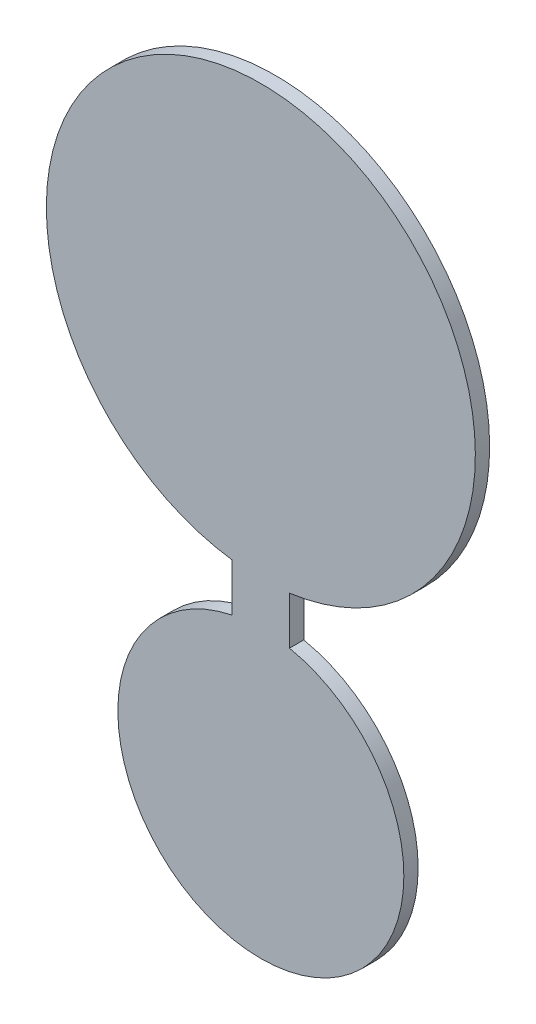
from build123d import *

# Parameters (mm, degrees)
SKETCH1_R           = 150
SKETCH1_R_2         = 100
BOSS_EXTRUDE1_DEPTH = 5


with BuildPart() as part:
    # Sketch1 → Boss-Extrude1 (new, symmetric)
    with BuildSketch(Plane.XY):
        with Locations((0, 280)):
            Circle(SKETCH1_R)
        Circle(SKETCH1_R_2)
        with BuildLine():
            Line((-20, 0), (-20, 280))
            ThreePointArc((-20, 280), (0, 300), (20, 280))
            Line((20, 280), (20, 0))
            ThreePointArc((20, 0), (0, -20), (-20, 0))
        make_face()
    extrude(amount=BOSS_EXTRUDE1_DEPTH, both=True)


solid = part.part
